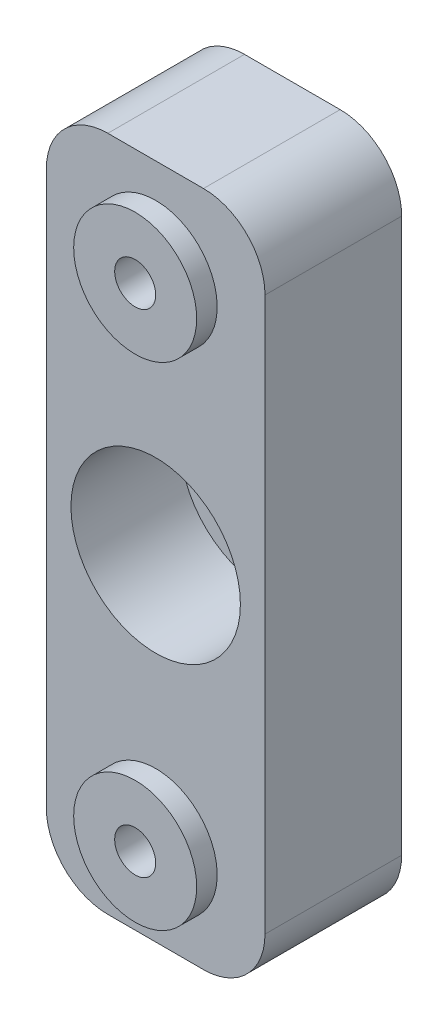
from build123d import *

# Parameters (mm, degrees)
SALIENTE_EXTRUIR1_DEPTH = 10
CORTAR_EXTRUIR2_DEPTH   = 2.5
CROQUIS3_R              = 4.5
SALIENTE_EXTRUIR2_DEPTH = 1.5
CROQUIS4_R              = 1.5
CORTAR_EXTRUIR3_DEPTH   = 58.982756057
CROQUIS5_R              = 6.2
CORTAR_EXTRUIR4_DEPTH   = 8


with BuildPart() as part:
    # Croquis1 → Saliente-Extruir1 (new body)
    with BuildSketch(Plane(origin=(0, 0, 0), x_dir=(-1, 0, 0), z_dir=(0, 0, -1))):
        with BuildLine():
            Line((-11.5, 55), (-4.5, 55))
            ThreePointArc((-4.5, 55), (-1.318019485, 53.681980515), (0, 50.5))
            Line((0, 50.5), (0, 10))
            ThreePointArc((0, 10), (-1.318019485, 6.818019485), (-4.5, 5.5))
            Line((-4.5, 5.5), (-11.5, 5.5))
            ThreePointArc((-11.5, 5.5), (-14.681980515, 6.818019485), (-16, 10))
            Line((-16, 10), (-16, 50.5))
            ThreePointArc((-16, 50.5), (-14.681980515, 53.681980515), (-11.5, 55))
        make_face()
    extrude(amount=-SALIENTE_EXTRUIR1_DEPTH)

    # Croquis2 → Cortar-Extruir2 (cut)
    with BuildSketch(Plane(origin=(0, 0, 0), x_dir=(-1, 0, 0), z_dir=(0, 0, -1))):
        Polygon((-8, 51.5), (-11.031088913, 49.75), (-11.031088913, 46.25), (-8, 44.5), (-4.968911087, 46.25), (-4.968911087, 49.75), align=None)
        Polygon((-8, 15.5), (-11.031088913, 13.75), (-11.031088913, 10.25), (-8, 8.5), (-4.968911087, 10.25), (-4.968911087, 13.75), align=None)
    extrude(amount=-CORTAR_EXTRUIR2_DEPTH, mode=Mode.SUBTRACT)

    # Croquis3 → Saliente-Extruir2 (add)
    with BuildSketch(Plane.XY.offset(10)):
        with Locations(Location((8, 48, 0), (0, 0, 180))):
            Circle(CROQUIS3_R)
        with Locations(Location((8, 12, 0), (0, 0, 180))):
            Circle(CROQUIS3_R)
    extrude(amount=SALIENTE_EXTRUIR2_DEPTH)

    # Croquis4 → Cortar-Extruir3 (cut, through all)
    with BuildSketch(Plane(origin=(0, 0, 2.5), x_dir=(-1, 0, 0), z_dir=(0, 0, -1))):
        with Locations((-8, 48)):
            Circle(CROQUIS4_R)
        with Locations((-8, 12)):
            Circle(CROQUIS4_R)
    extrude(amount=-CORTAR_EXTRUIR3_DEPTH, mode=Mode.SUBTRACT)

    # Croquis5 → Cortar-Extruir4 (cut)
    with BuildSketch(Plane.XY.offset(10)):
        with Locations((8, 30)):
            Circle(CROQUIS5_R)
    extrude(amount=-CORTAR_EXTRUIR4_DEPTH, mode=Mode.SUBTRACT)


solid = part.part
